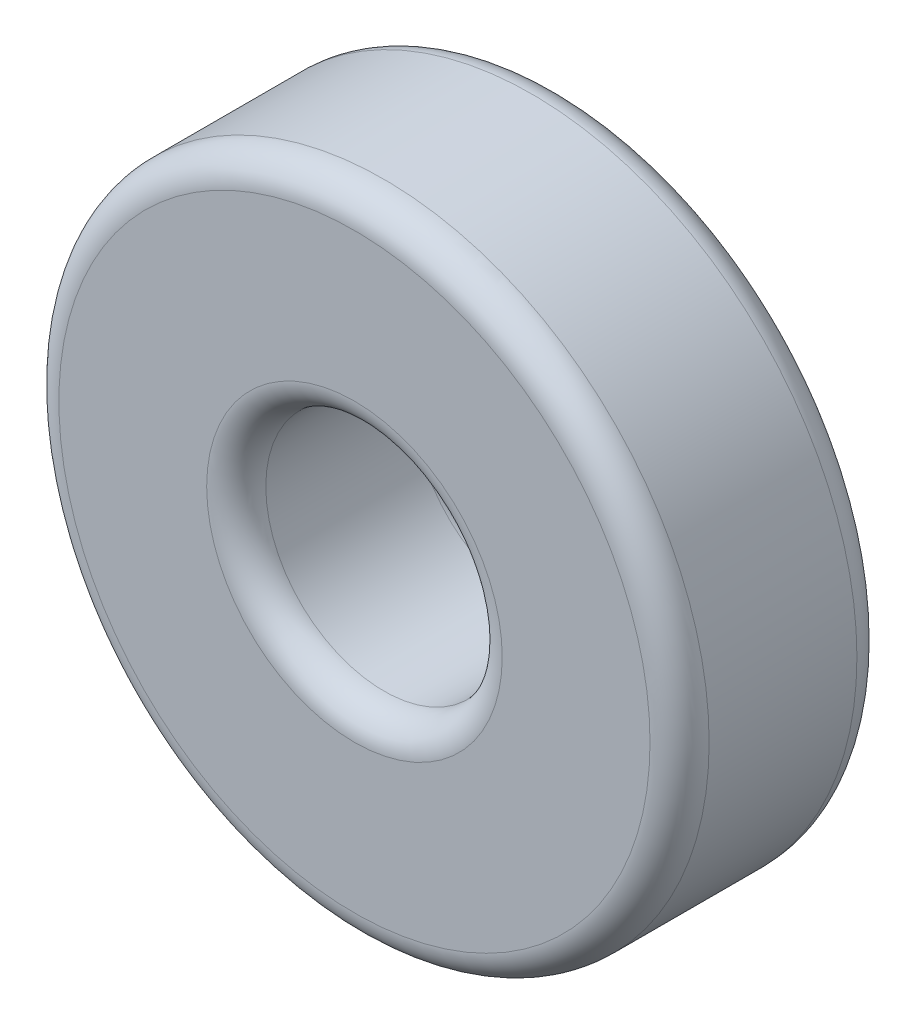
from build123d import *

# Parameters (mm, degrees)
SKETCH2_R           = 11
SKETCH2_R_2         = 4
BOSS_EXTRUDE1_DEPTH = 7
FILLET1_R           = 1


with BuildPart() as part:
    # Sketch2 → Boss-Extrude1 (new body)
    with BuildSketch(Plane(origin=(0, 0, 0), x_dir=(0, 1, 0), z_dir=(0, 0, 1))):
        with Locations(Location((0, 0, 0), (0, 0, 270))):
            Circle(SKETCH2_R)
        with Locations(Location((0, 0, 0), (0, 0, 270))):
            Circle(SKETCH2_R_2, mode=Mode.SUBTRACT)
    extrude(amount=BOSS_EXTRUDE1_DEPTH)

    # Fillet1
    fillet1_edges = [part.edges().sort_by_distance(p)[0] for p in [
        (-11, 0, 0),
        (-11, 0, 7),
        (-4, 0, 0),
        (-4, 0, 7),
    ]]
    fillet(fillet1_edges, radius=FILLET1_R)


solid = part.part
